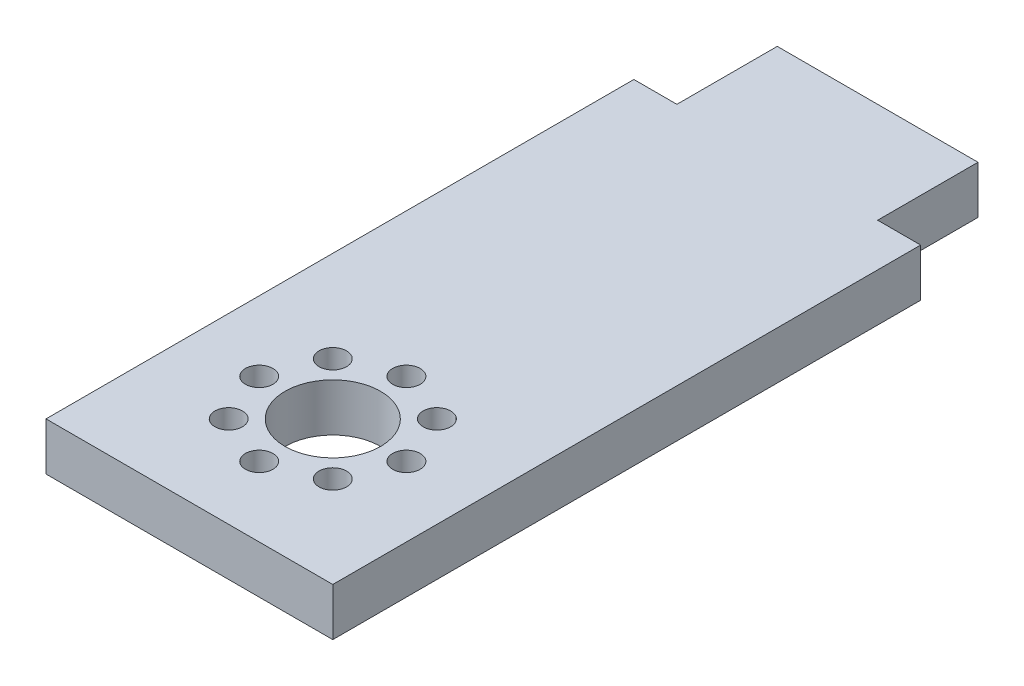
from build123d import *

# Parameters (mm, degrees)
SKETCH1_R           = 6.35
SKETCH1_R_2         = 1.8288
BOSS_EXTRUDE1_DEPTH = 6.35
SKETCH2_W           = 26.667
SKETCH2_H           = 26.667
BOSS_EXTRUDE2_DEPTH = 6.35


with BuildPart() as part:
    # Sketch1 → Boss-Extrude1 (new body)
    with BuildSketch(Plane(origin=(0, 0, 0), x_dir=(1, 0, 0), z_dir=(0, 1, 0))):
        Polygon((-35.064474094, 47.36223941), (-35.064474094, 7.36323941), (-35.064474094, -30.73676059), (3.035525906, -30.73676059), (3.035525906, 7.36323941), (3.035525906, 47.36223941), align=None)
        with Locations(Location((-16.014474094, -11.68676059, 0), (0, 0, 270))):
            Circle(SKETCH1_R, mode=Mode.SUBTRACT)
        with Locations(Location((-16.014474094, -21.46576059, 0), (0, 0, 270))):
            Circle(SKETCH1_R_2, mode=Mode.SUBTRACT)
        with Locations(Location((-22.929271308, -18.601557803, 0), (0, 0, 270))):
            Circle(SKETCH1_R_2, mode=Mode.SUBTRACT)
        with Locations(Location((-25.793474094, -11.68676059, 0), (0, 0, 270))):
            Circle(SKETCH1_R_2, mode=Mode.SUBTRACT)
        with Locations(Location((-22.929271308, -4.771963377, 0), (0, 0, 270))):
            Circle(SKETCH1_R_2, mode=Mode.SUBTRACT)
        with Locations(Location((-16.014474094, -1.90776059, 0), (0, 0, 270))):
            Circle(SKETCH1_R_2, mode=Mode.SUBTRACT)
        with Locations(Location((-9.099676881, -4.771963377, 0), (0, 0, 270))):
            Circle(SKETCH1_R_2, mode=Mode.SUBTRACT)
        with Locations(Location((-6.235474094, -11.68676059, 0), (0, 0, 270))):
            Circle(SKETCH1_R_2, mode=Mode.SUBTRACT)
        with Locations(Location((-9.099676881, -18.601557803, 0), (0, 0, 270))):
            Circle(SKETCH1_R_2, mode=Mode.SUBTRACT)
    extrude(amount=BOSS_EXTRUDE1_DEPTH)

    # Sketch2 → Boss-Extrude2 (add)
    with BuildSketch(Plane(origin=(0, 6.35, 0), x_dir=(1, 0, 0), z_dir=(0, 1, 0))):
        with Locations((-16.014474094, 47.36223941)):
            Rectangle(SKETCH2_W, SKETCH2_H)
    extrude(amount=-BOSS_EXTRUDE2_DEPTH)


solid = part.part
